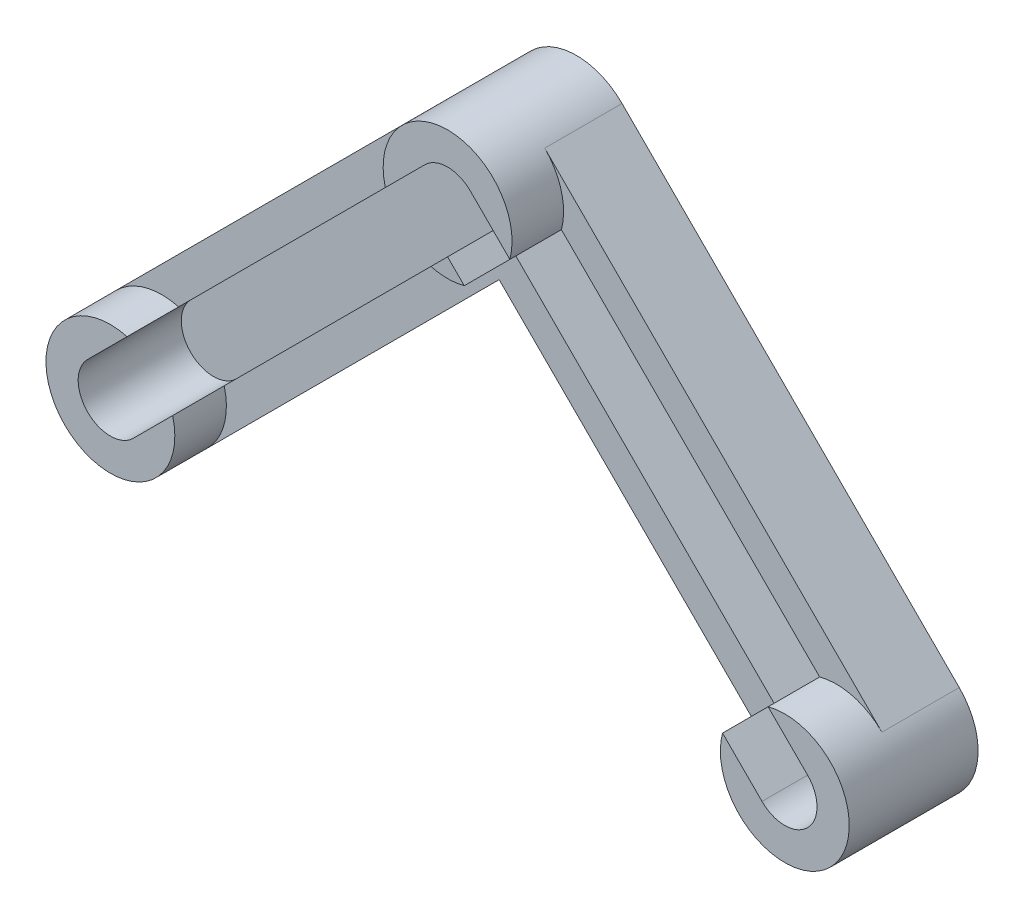
from build123d import *

# Parameters (mm, degrees)
SKETCH_1_R          = 5
SKETCH_1_R_2        = 2.5
EXTRUDE_1_DEPTH     = 10
EXTRUDE_1_2_DEPTH   = 10
EXTRUDE_1_3_DEPTH   = 10
EXTRUDE_2_DEPTH     = 6
EXTRUDE_4_DEPTH     = 6
CUT_EXTRUDE_1_DEPTH = 4
SKETCH_5_R          = 3.75
SKETCH_5_R_2        = 2.5
EXTRUDE_3_DEPTH     = 2
CUT_EXTRUDE_2_DEPTH = 4
CUT_EXTRUDE_3_DEPTH = 8
SKETCH_11_R         = 2.5
EXTRUDE_9_DEPTH     = 2


with BuildPart() as part:
    # Эскиз1 → Бобышка-Вытянуть1 (new body)
    with BuildSketch(Plane.XY):
        with Locations((-12.085916667, 0.414052586)):
            Circle(SKETCH_1_R)
        with Locations((-12.085916667, 0.414052586)):
            Circle(SKETCH_1_R_2, mode=Mode.SUBTRACT)
    extrude(amount=EXTRUDE_1_DEPTH)



with BuildPart() as body_2:
    # Эскиз1 → Extrude 1 2 (new body)
    with BuildSketch(Plane.XY):
        with Locations((-38.24886757, -25.748898318)):
            Circle(SKETCH_1_R)
        with Locations((-38.24886757, -25.748898318)):
            Circle(SKETCH_1_R_2, mode=Mode.SUBTRACT)
    extrude(amount=EXTRUDE_1_2_DEPTH)


with BuildPart() as body_3:
    # Эскиз1 → Extrude 1 3 (new body)
    with BuildSketch(Plane.XY):
        with Locations((14.077034237, -25.748898318)):
            Circle(SKETCH_1_R)
        with Locations((14.077034237, -25.748898318)):
            Circle(SKETCH_1_R_2, mode=Mode.SUBTRACT)
    extrude(amount=EXTRUDE_1_3_DEPTH)


with BuildPart() as part_1:
    add(part.part)

    add(body_2.part)  # Бобышка-Вытянуть2 merges body 2
    # Эскиз3 → Бобышка-Вытянуть2 (add)
    with BuildSketch(Plane(origin=(0, 0, 0), x_dir=(-1, 0, 0), z_dir=(0, 0, -1))):
        Polygon((12.085916667, 0.414052586), (15.621450572, 3.949586492), (41.784401476, -22.213364412), (34.713333665, -29.284432224), (8.550382761, -3.12148132), align=None)
    extrude(amount=-EXTRUDE_2_DEPTH)


    add(body_3.part)  # Бобышка-Вытянуть4 merges body 3
    # Эскиз9 → Бобышка-Вытянуть4 (add)
    with BuildSketch(Plane(origin=(0, 0, 0), x_dir=(-1, 0, 0), z_dir=(0, 0, -1))):
        Polygon((-14.077034237, -25.748898318), (-17.612568143, -22.213364412), (8.550382761, 3.949586492), (15.621450572, -3.12148132), (-10.541500331, -29.284432224), align=None)
    extrude(amount=-EXTRUDE_4_DEPTH)

    # Эскиз4 → Вырез-Вытянуть1 (cut)
    with BuildSketch(Plane.XY.offset(6)):
        Polygon((-13.85368362, 2.181819539), (-10.318149714, -1.353714367), (-36.481100617, -27.516665271), (-40.016634523, -23.981131365), align=None)
    extrude(amount=-CUT_EXTRUDE_1_DEPTH, mode=Mode.SUBTRACT)

    # Эскиз5 → Бобышка-Вытянуть3 (add)
    with BuildSketch(Plane(origin=(0, 0, 0), x_dir=(-1, 0, 0), z_dir=(0, 0, -1))):
        with Locations((12.969800143, 1.297936063)):
            Circle(SKETCH_5_R)
        with Locations((38.24886757, -25.748898318)):
            Circle(SKETCH_5_R_2)
    extrude(amount=-EXTRUDE_3_DEPTH)

    # Эскиз4<2> → Вырез-Вытянуть2 (cut)
    with BuildSketch(Plane.XY.offset(6)):
        Polygon((-13.85368362, 2.181819539), (-10.318149714, -1.353714367), (-36.481100617, -27.516665271), (-40.016634523, -23.981131365), align=None)
    extrude(amount=CUT_EXTRUDE_2_DEPTH, mode=Mode.SUBTRACT)

    # Эскиз10 → Вырез-Вытянуть3 (cut)
    with BuildSketch(Plane.XY.offset(10)):
        Polygon((14.077034237, -25.748898318), (12.309267284, -27.516665271), (-13.85368362, -1.353714367), (-12.085916667, 0.414052586), (-10.318149714, 2.181819539), (15.84480119, -23.981131365), align=None)
    extrude(amount=-CUT_EXTRUDE_3_DEPTH, mode=Mode.SUBTRACT)

    # Эскиз11 → Бобышка-Вытянуть9 (add)
    with BuildSketch(Plane(origin=(0, 0, 0), x_dir=(-1, 0, 0), z_dir=(0, 0, -1))):
        with Locations((-14.077034237, -25.748898318)):
            Circle(SKETCH_11_R)
    extrude(amount=-EXTRUDE_9_DEPTH)


solid = part_1.part
